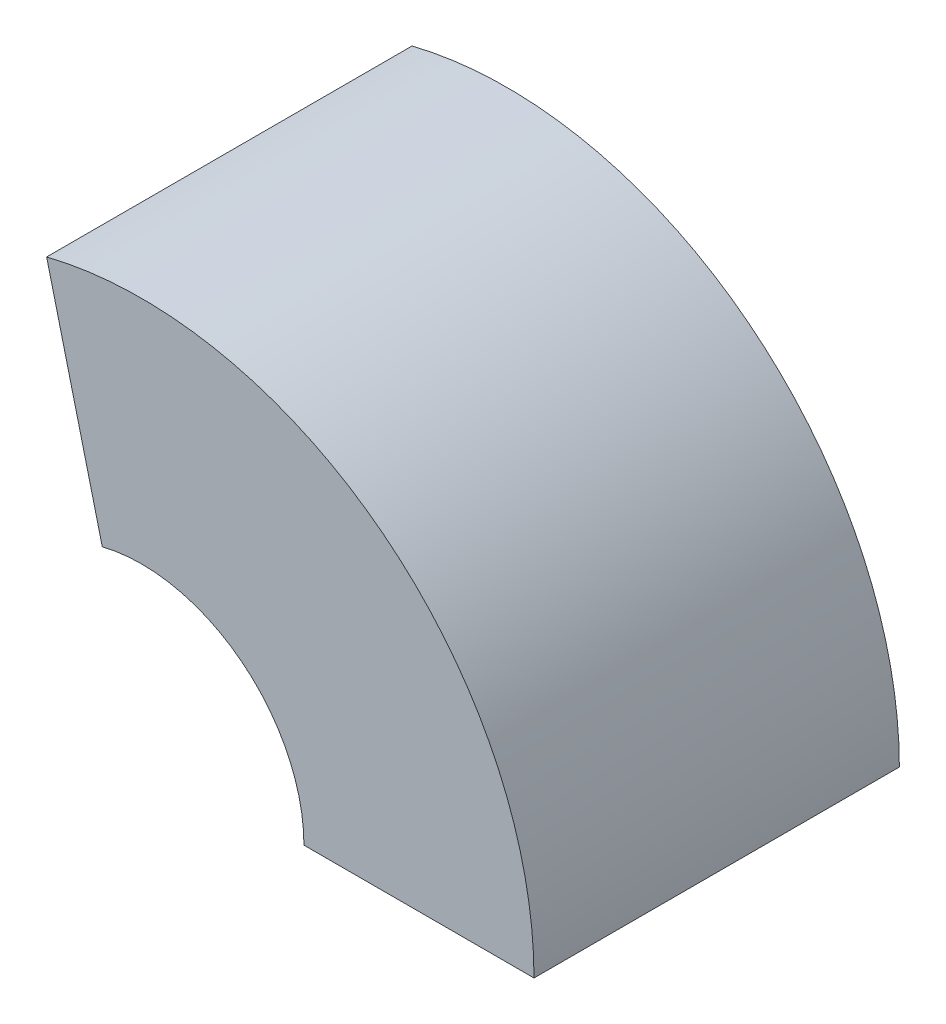
from build123d import *

# Parameters (mm, degrees)
REVOLVESKETCH_W           = 17
REVOLVESKETCH_H           = 27
ORDINARYBOSSREVOLVE_ANGLE = 104


with BuildPart() as part:
    # RevolveSketch → OrdinaryBossRevolve (revolve)
    with BuildSketch(Plane(origin=(0, 0, 0), x_dir=(1, 0, 0), z_dir=(0, 1, 0))):
        with Locations((24.5, 2.5)):
            Rectangle(REVOLVESKETCH_W, REVOLVESKETCH_H)
    revolve(axis=Axis((4, 0, 16), (0, 0, 1)), revolution_arc=ORDINARYBOSSREVOLVE_ANGLE)


solid = part.part
